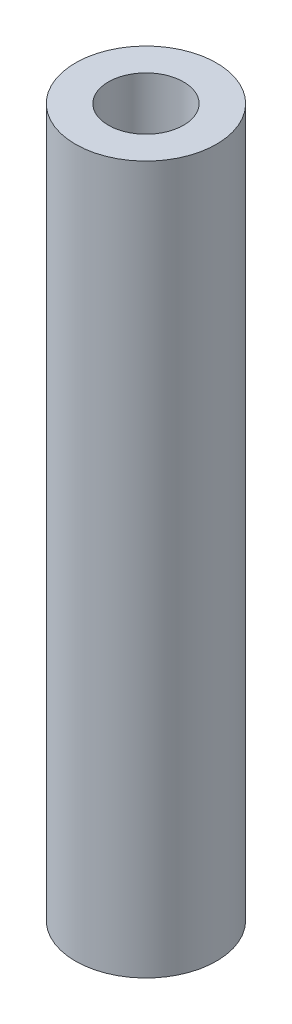
from build123d import *

# Parameters (mm, degrees)
SKETCH_1_R          = 7.5
EXTRUDE_1_DEPTH     = 75.26
SKETCH_3_R          = 4
CUT_EXTRUDE_1_DEPTH = 21.36


with BuildPart() as part:
    # 스케치1 → 보스-돌출1 (new body)
    with BuildSketch(Plane(origin=(0, 0, 0), x_dir=(1, 0, 0), z_dir=(0, 1, 0))):
        with Locations(Location((0, 0, 0), (0, 0, 270))):
            Circle(SKETCH_1_R)
    extrude(amount=-EXTRUDE_1_DEPTH)

    # 스케치3 → 컷-돌출1 (cut)
    with BuildSketch(Plane(origin=(0, 0, 0), x_dir=(1, 0, 0), z_dir=(0, 1, 0))):
        with Locations(Location((0, 0, 0), (0, 0, 270))):
            Circle(SKETCH_3_R)
    extrude(amount=-CUT_EXTRUDE_1_DEPTH, mode=Mode.SUBTRACT)


solid = part.part
